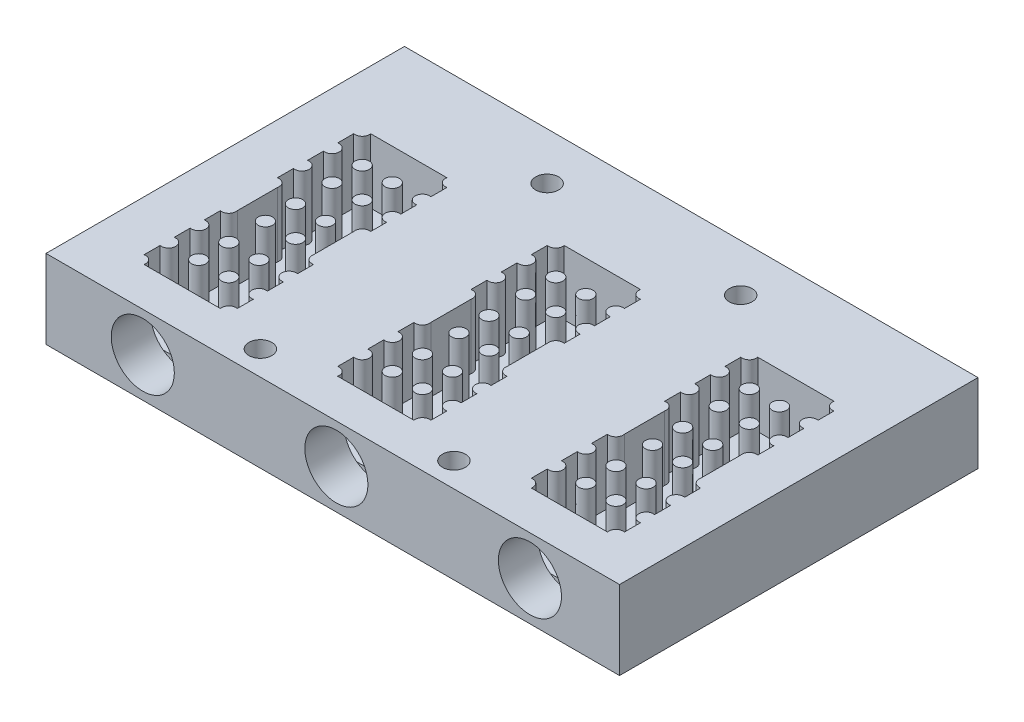
from build123d import *

# Parameters (mm, degrees)
SKIZZE1_W                       = 80
SKIZZE1_H                       = 50
AUFSATZ_LINEAR_AUSTRAGEN1_DEPTH = 11
SKIZZE2_R                       = 1.6
SCHNITT_LINEAR_AUSTRAGEN1_DEPTH = 11
SKIZZE3_W                       = 13
SKIZZE3_H                       = 13
SCHNITT_LINEAR_AUSTRAGEN2_DEPTH = 9
G1_8_GEWINDEBOHRUNG1_D          = 8.8
G1_8_GEWINDEBOHRUNG1_DEPTH      = 5.5
SKIZZE10_R                      = 1.000126903
AUFSATZ_LINEAR_AUSTRAGEN2_DEPTH = 9
LINEARES_MUSTER1_COUNT          = 3
LINEARES_MUSTER1_PITCH          = 27
LINEARES_MUSTER1_COUNT_DIR2     = 2
LINEARES_MUSTER1_PITCH_DIR2     = 18.6
SKIZZE11_W                      = 10.640149168
SKIZZE11_H                      = 5.6
SCHNITT_LINEAR_AUSTRAGEN3_DEPTH = 9
LINEARES_MUSTER2_COUNT          = 3
LINEARES_MUSTER2_PITCH          = 27
SKIZZE12_R                      = 1
AUFSATZ_LINEAR_AUSTRAGEN3_DEPTH = 9
LINEARES_MUSTER3_COUNT          = 3
LINEARES_MUSTER3_PITCH          = 27


with BuildPart() as part:
    # Skizze1 → Aufsatz-Linear austragen1 (new body)
    with BuildSketch(Plane(origin=(0, 0, 0), x_dir=(1, 0, 0), z_dir=(0, 1, 0))):
        with Locations((40, 25)):
            Rectangle(SKIZZE1_W, SKIZZE1_H)
    extrude(amount=AUFSATZ_LINEAR_AUSTRAGEN1_DEPTH)

    # Skizze2 → Schnitt-Linear austragen1 (cut)
    with BuildSketch(Plane(origin=(0, 11, 0), x_dir=(1, 0, 0), z_dir=(0, 1, 0))):
        with Locations(Location((26.5, 3.4, 0), (0, 0, 270))):
            Circle(SKIZZE2_R)
        with Locations(Location((53.5, 3.4, 0), (0, 0, 270))):
            Circle(SKIZZE2_R)
        with Locations(Location((53.5, 43.4, 0), (0, 0, 270))):
            Circle(SKIZZE2_R)
        with Locations(Location((26.5, 43.4, 0), (0, 0, 270))):
            Circle(SKIZZE2_R)
    extrude(amount=-SCHNITT_LINEAR_AUSTRAGEN1_DEPTH, mode=Mode.SUBTRACT)

    # Skizze3 → Schnitt-Linear austragen2 (cut)
    with BuildSketch(Plane(origin=(0, 11, 0), x_dir=(1, 0, 0), z_dir=(0, 1, 0))):
        with Locations((13.5, 12)):
            Rectangle(SKIZZE3_W, SKIZZE3_H)
        with Locations((40.5, 12)):
            Rectangle(SKIZZE3_W, SKIZZE3_H)
        with Locations((67.5, 12)):
            Rectangle(SKIZZE3_W, SKIZZE3_H)
        with Locations((40.5, 30.6)):
            Rectangle(SKIZZE3_W, SKIZZE3_H)
        with Locations((67.5, 30.6)):
            Rectangle(SKIZZE3_W, SKIZZE3_H)
        with Locations((13.5, 30.6)):
            Rectangle(SKIZZE3_W, SKIZZE3_H)
    extrude(amount=-SCHNITT_LINEAR_AUSTRAGEN2_DEPTH, mode=Mode.SUBTRACT)

    # G1/8 Gewindebohrung1
    with Locations(Plane.XY):
        with Locations((13.5, 5.5), (40.5, 5.5), (67.5, 5.5)):
            Hole(G1_8_GEWINDEBOHRUNG1_D / 2, depth=G1_8_GEWINDEBOHRUNG1_DEPTH)

    # Skizze10 → Aufsatz-Linear austragen2 (add)
    with BuildSketch(Plane(origin=(0, 2, 0), x_dir=(1, 0, 0), z_dir=(0, 1, 0))):
        with Locations((7.2, 5.7)):
            Circle(SKIZZE10_R)
        with Locations((19.8, 5.7)):
            Circle(SKIZZE10_R)
        with Locations(Location((11.4, 9.9, 0), (0, 0, 270))):
            Circle(SKIZZE10_R)
        with Locations(Location((15.6, 9.9, 0), (0, 0, 270))):
            Circle(SKIZZE10_R)
        with Locations((19.8, 9.9)):
            Circle(SKIZZE10_R)
        with Locations(Location((11.4, 14.1, 0), (0, 0, 270))):
            Circle(SKIZZE10_R)
        with Locations(Location((15.6, 14.1, 0), (0, 0, 270))):
            Circle(SKIZZE10_R)
        with Locations((19.8, 14.1)):
            Circle(SKIZZE10_R)
        with Locations((19.8, 18.3)):
            Circle(SKIZZE10_R)
        with Locations((7.2, 9.9)):
            Circle(SKIZZE10_R)
        with Locations((7.2, 14.1)):
            Circle(SKIZZE10_R)
        with Locations((7.2, 18.3)):
            Circle(SKIZZE10_R)
    aufsatz_linear_austragen2 = extrude(amount=AUFSATZ_LINEAR_AUSTRAGEN2_DEPTH)

    # Lineares Muster1: Aufsatz-Linear austragen2 3 × 2
    with Locations(*[(i * LINEARES_MUSTER1_PITCH, 0, -j * LINEARES_MUSTER1_PITCH_DIR2) for i in range(LINEARES_MUSTER1_COUNT) for j in range(LINEARES_MUSTER1_COUNT_DIR2) if (i, j) != (0, 0)]):
        add(aufsatz_linear_austragen2)

    # Skizze11 → Schnitt-Linear austragen3 (cut)
    with BuildSketch(Plane(origin=(0, 11, 0), x_dir=(1, 0, 0), z_dir=(0, 1, 0))):
        with Locations((13.5, 21.3)):
            Rectangle(SKIZZE11_W, SKIZZE11_H)
    schnitt_linear_austragen3 = extrude(amount=-SCHNITT_LINEAR_AUSTRAGEN3_DEPTH, mode=Mode.SUBTRACT)

    # Lineares Muster2: Schnitt-Linear austragen3 ×3
    with Locations(*[(i * LINEARES_MUSTER2_PITCH, 0, 0) for i in range(1, LINEARES_MUSTER2_COUNT)]):
        add(schnitt_linear_austragen3, mode=Mode.SUBTRACT)

    # Skizze12 → Aufsatz-Linear austragen3 (add)
    with BuildSketch(Plane(origin=(0, 2, 0), x_dir=(1, 0, 0), z_dir=(0, 1, 0))):
        with Locations(Location((11.4, 19.2, 0), (0, 0, 270))):
            Circle(SKIZZE12_R)
        with Locations(Location((15.6, 19.2, 0), (0, 0, 270))):
            Circle(SKIZZE12_R)
        with Locations(Location((15.6, 23.4, 0), (0, 0, 270))):
            Circle(SKIZZE12_R)
        with Locations(Location((11.4, 23.4, 0), (0, 0, 270))):
            Circle(SKIZZE12_R)
    aufsatz_linear_austragen3 = extrude(amount=AUFSATZ_LINEAR_AUSTRAGEN3_DEPTH)

    # Lineares Muster3: Aufsatz-Linear austragen3 ×3
    with Locations(*[(i * LINEARES_MUSTER3_PITCH, 0, 0) for i in range(1, LINEARES_MUSTER3_COUNT)]):
        add(aufsatz_linear_austragen3)


solid = part.part
